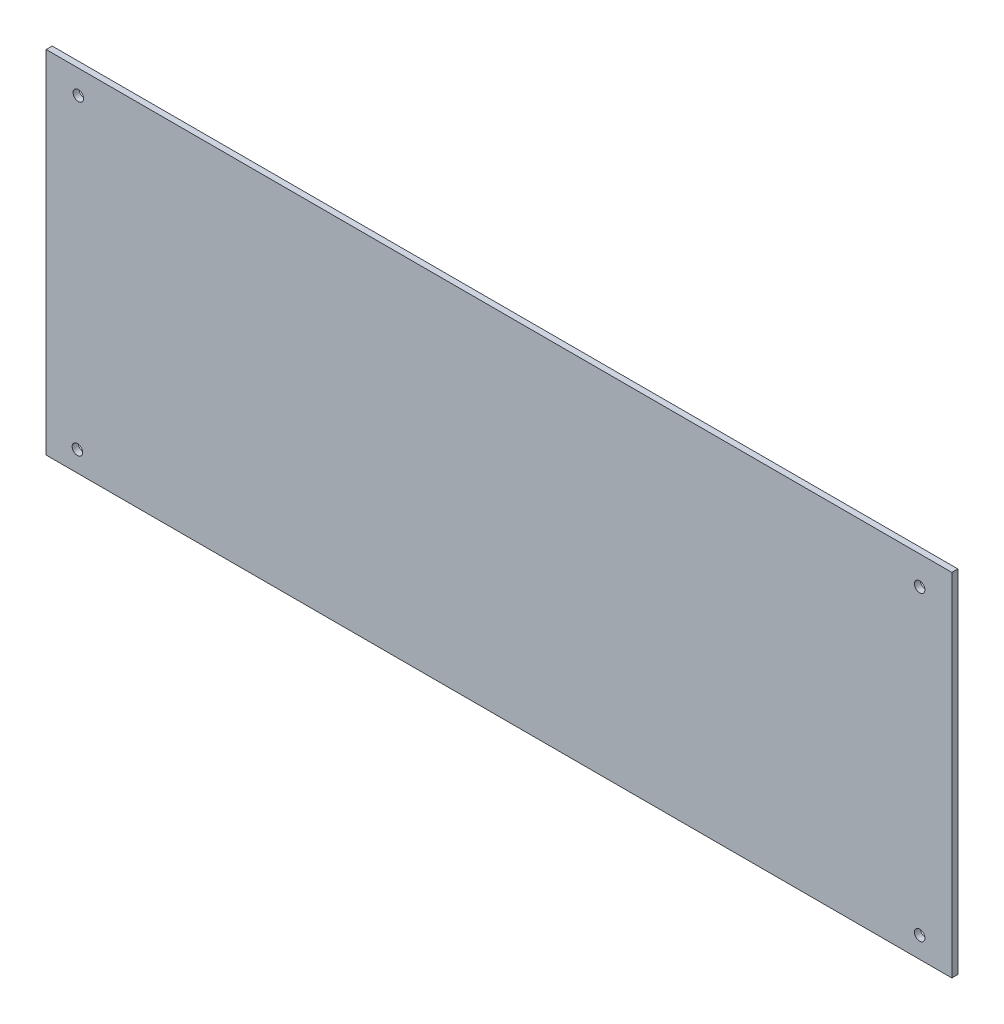
from build123d import *

# Parameters (mm, degrees)
ESQUISSE1_W             = 450.3
ESQUISSE1_H             = 174.64
BOSS_EXTRU_1_DEPTH      = 3
ESQUISSE2_R             = 2.6
ENL_V_MAT_EXTRU_1_DEPTH = 20


with BuildPart() as part:
    # Esquisse1 → Boss.-Extru.1 (new body)
    with BuildSketch(Plane.XY):
        with Locations((-225.15, 87.32)):
            Rectangle(ESQUISSE1_W, ESQUISSE1_H)
    extrude(amount=BOSS_EXTRU_1_DEPTH)

    # Esquisse2 → Enlèv. mat.-Extru.1 (cut)
    with BuildSketch(Plane.XY.offset(3)):
        with Locations((-16, 160.425773655)):
            Circle(ESQUISSE2_R)
        with Locations((-16, 10.462671452)):
            Circle(ESQUISSE2_R)
        with Locations((-434.750971798, 10.177768017)):
            Circle(ESQUISSE2_R)
        with Locations((-434.3, 162.816794702)):
            Circle(ESQUISSE2_R)
    extrude(amount=-ENL_V_MAT_EXTRU_1_DEPTH, mode=Mode.SUBTRACT)


solid = part.part
